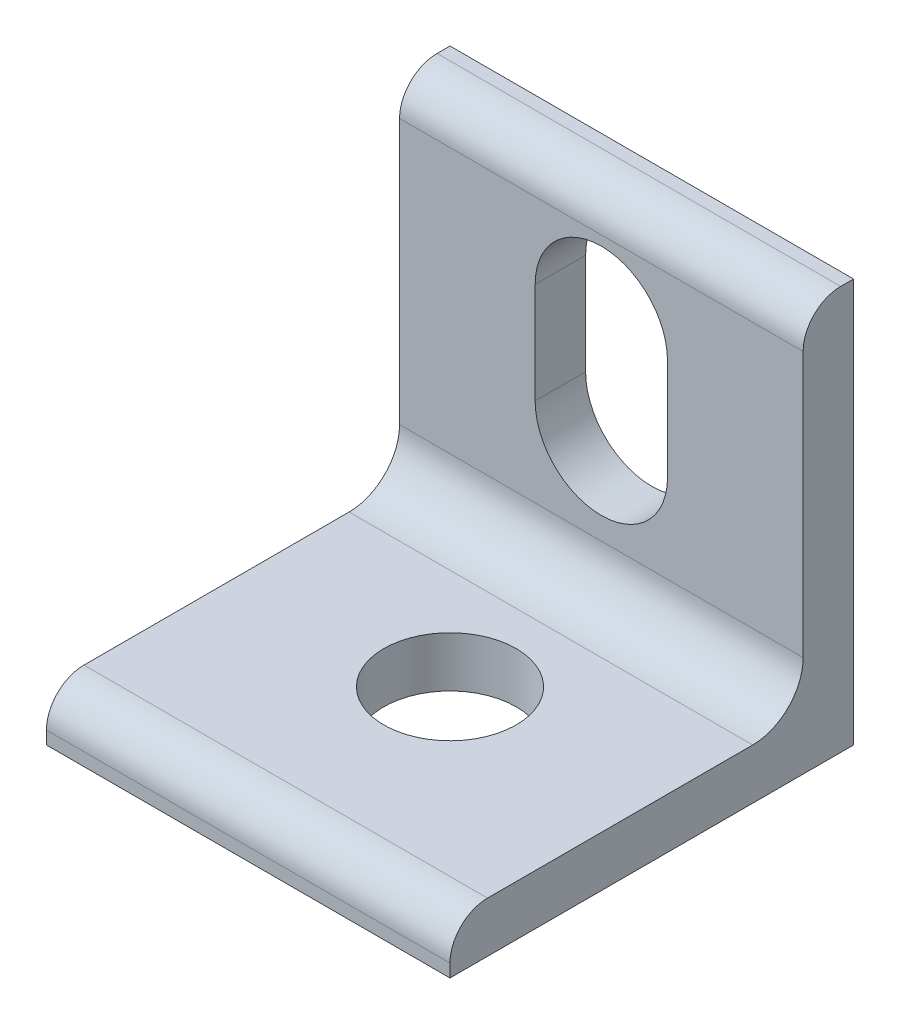
from build123d import *

# Parameters (mm, degrees)
SKETCH1_W                    = 25.4
SKETCH1_H                    = 25.4
BOSS_EXTRUDE1_DEPTH          = 25.4
SKETCH2_W                    = 22.225
SKETCH2_H                    = 22.225
CUT_EXTRUDE1_DEPTH           = 44.994090512
CUT_EXTRUDE2_DEPTH           = 39.1
F_5_16_CLEARANCE_HOLE1_D     = 8.3312
F_5_16_CLEARANCE_HOLE1_DEPTH = 25.4
FILLET1_R                    = 2.3622
FILLET2_R                    = 3.175


with BuildPart() as part:
    # Sketch1 → Boss-Extrude1 (new body)
    with BuildSketch(Plane(origin=(12.7, 0, 0), x_dir=(0, 0, -1), z_dir=(1, 0, 0))):
        with Locations((-12.7, 12.7)):
            Rectangle(SKETCH1_W, SKETCH1_H)
    extrude(amount=-BOSS_EXTRUDE1_DEPTH)

    # Sketch2 → Cut-Extrude1 (cut, through all)
    with BuildSketch(Plane.ZY.offset(12.7)):
        with Locations((14.2875, 14.2875)):
            Rectangle(SKETCH2_W, SKETCH2_H)
    extrude(amount=-CUT_EXTRUDE1_DEPTH, mode=Mode.SUBTRACT)

    # Sketch3 → Cut-Extrude2 (cut, through all)
    with BuildSketch(Plane(origin=(0, 0, 0), x_dir=(-1, 0, 0), z_dir=(0, 0, -1))):
        with BuildLine():
            Line((-4.1656, 18.2626), (-4.1656, 11.9126))
            ThreePointArc((-4.1656, 11.9126), (0, 7.747), (4.1656, 11.9126))
            Line((4.1656, 11.9126), (4.1656, 18.2626))
            ThreePointArc((4.1656, 18.2626), (0, 22.4282), (-4.1656, 18.2626))
        make_face()
    extrude(amount=-CUT_EXTRUDE2_DEPTH, mode=Mode.SUBTRACT)

    # 5/16 Clearance Hole1
    with Locations(Plane(origin=(0, 0, 0), x_dir=(-1, 0, 0), z_dir=(0, -1, 0))):
        with Locations((0, -12.7)):
            Hole(F_5_16_CLEARANCE_HOLE1_D / 2, depth=F_5_16_CLEARANCE_HOLE1_DEPTH)

    # Fillet1
    fillet1_edges = [part.edges().sort_by_distance(p)[0] for p in [
        (0, 25.4, 3.175),
        (0, 3.175, 25.4),
    ]]
    fillet(fillet1_edges, radius=FILLET1_R)

    # Fillet2
    fillet2_edges = [part.edges().sort_by_distance(p)[0] for p in [
        (0, 3.175, 3.175),
    ]]
    fillet(fillet2_edges, radius=FILLET2_R)


solid = part.part
